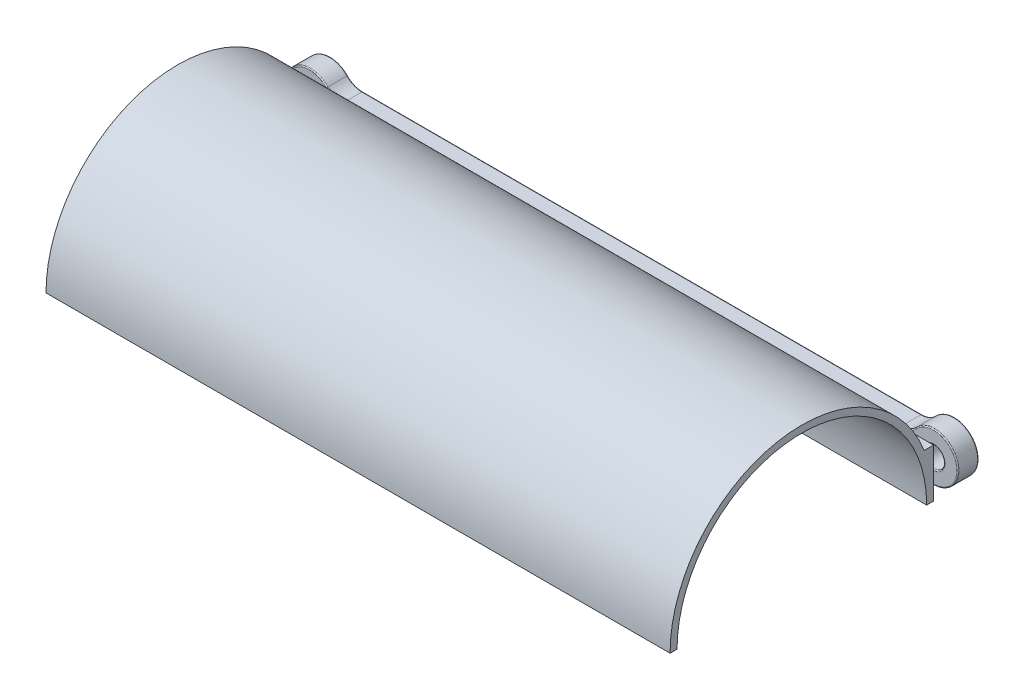
from build123d import *

# Parameters (mm, degrees)
SKETCH1_R           = 3.5
SKETCH1_R_2         = 1.5
BOSS_EXTRUDE1_DEPTH = 1.5
FILLET1_R           = 3
FILLET2_R           = 0.15
EXTRUDE_2_DEPTH     = 90


with BuildPart() as part:
    # Sketch1 → Boss-Extrude1 (new, symmetric)
    # profile 1 of 3: a face of its own
    with BuildSketch(Plane.XY):
        Circle(SKETCH1_R)
        Circle(SKETCH1_R_2, mode=Mode.SUBTRACT)
    # profile 2 of 3: a face of its own
    with BuildSketch(Plane.XY):
        with BuildLine():
            ThreePointArc((3.5, 0), (3.414525722, -0.768774411), (3.16227766, -1.5))
            Line((3.16227766, -1.5), (86.83772234, -1.5))
            ThreePointArc((86.83772234, -1.5), (86.5, 0), (86.83772234, 1.5))
            Line((86.83772234, 1.5), (3.16227766, 1.5))
            ThreePointArc((3.16227766, 1.5), (3.414525722, 0.768774411), (3.5, 0))
        make_face()
    # profile 3 of 3: a face of its own
    with BuildSketch(Plane.XY):
        with Locations((90, 0)):
            Circle(SKETCH1_R)
        with Locations((90, 0)):
            Circle(SKETCH1_R_2, mode=Mode.SUBTRACT)
    extrude(amount=BOSS_EXTRUDE1_DEPTH, both=True)

    # Fillet1
    fillet1_edges = [part.edges().sort_by_distance(p)[0] for p in [
        (86.83772234, 1.5, 0),
        (86.83772234, -1.5, 0),
        (3.16227766, -1.5, 0),
        (3.16227766, 1.5, 0),
    ]]
    fillet(fillet1_edges, radius=FILLET1_R)

    # Fillet2
    fillet2_edges = [part.edges().sort_by_distance(p)[0] for p in [
        (45, -1.5, -1.5),
        (45, -1.5, 1.5),
        (-1.5, 0, 1.5),
        (-3.5, 0, -1.5),
        (-3.5, 0, 1.5),
        (93.5, 0, -1.5),
        (93.5, 0, 1.5),
        (88.5, 0, 1.5),
        (45, 1.5, -1.5),
        (45, 1.5, 1.5),
        (3.513718949, -1.740401367, -1.5),
        (3.513718949, -1.740401367, 1.5),
        (86.486281051, -1.740401367, -1.5),
        (86.486281051, -1.740401367, 1.5),
        (86.486281051, 1.740401367, -1.5),
        (86.486281051, 1.740401367, 1.5),
        (3.513718949, 1.740401367, -1.5),
        (3.513718949, 1.740401367, 1.5),
        (88.5, 0, -1.5),
        (-1.5, 0, -1.5),
    ]]
    fillet(fillet2_edges, radius=FILLET2_R)

    # 草图10 → 凸台-拉伸2 (add)
    with BuildSketch(Plane(origin=(90, 0, 0), x_dir=(0, 0, -1), z_dir=(1, 0, 0))):
        with BuildLine():
            Line((-1.5, -5.5), (-2.5, -5.5))
            ThreePointArc((-2.5, -5.5), (-20.5, 12.5), (-38.5, -5.5))
            Line((-38.5, -5.5), (-39.5, -5.5))
            ThreePointArc((-39.5, -5.5), (-24.06322095, 13.162889821), (-2.836478267, 1.5))
            Line((-2.836478267, 1.5), (-1.5, 1.5))
            Line((-1.5, 1.5), (-1.5, -5.5))
        make_face()
    extrude(amount=-EXTRUDE_2_DEPTH)


solid = part.part
